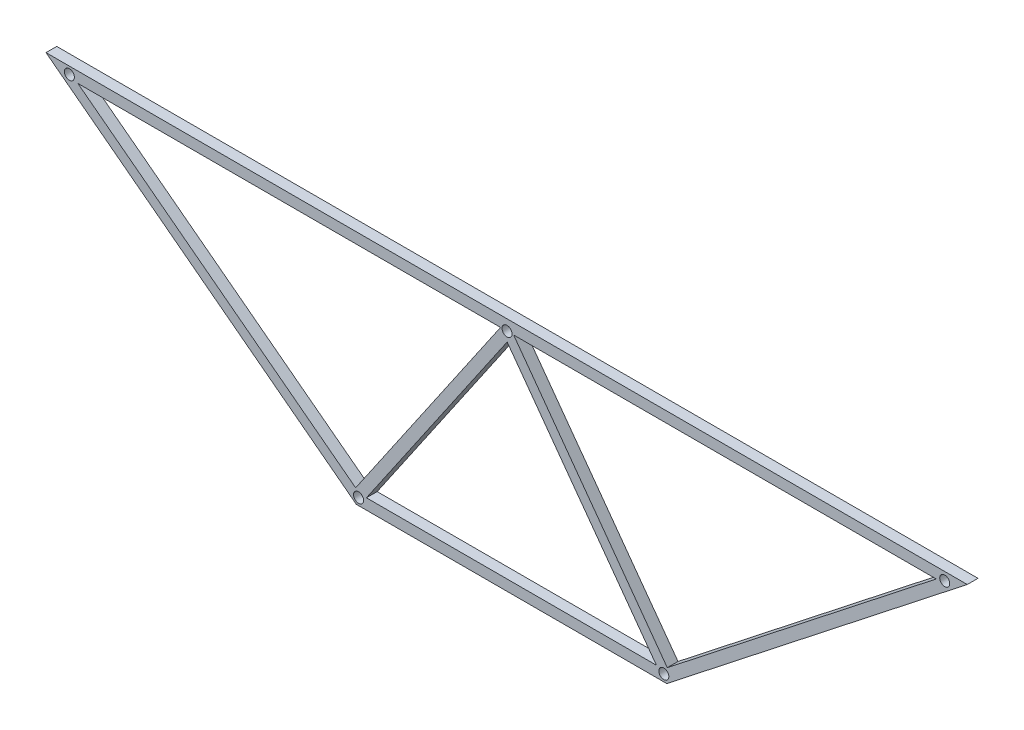
from build123d import *

# Parameters (mm, degrees)
BOSS_EXTRUDE1_DEPTH = 15
SKETCH2_R           = 7
CUT_EXTRUDE2_DEPTH  = 15


with BuildPart() as part:
    # Sketch1 → Boss-Extrude1 (new body)
    with BuildSketch(Plane.XY):
        Polygon((-644.492210058, 15), (643.375012356, 15), (223.310378922, -315), (-210.705614848, -315), align=None)
        Polygon((9.272865978, 0), (600, 0), (224.024883315, -295.363567011), align=None, mode=Mode.SUBTRACT)
        Polygon((-9.092968645, 0), (-600, 0), (-211.624925428, -295.453515678), align=None, mode=Mode.SUBTRACT)
        Polygon((208.850194536, -300), (-196.555581164, -300), (0.180367696, -13.001697737), align=None, mode=Mode.SUBTRACT)
    extrude(amount=BOSS_EXTRUDE1_DEPTH)

    # Sketch2 → Cut-Extrude2 (cut)
    with BuildSketch(Plane.XY.offset(15)):
        with Locations((-611.831081684, 4.904990628)):
            Circle(SKETCH2_R)
        Circle(SKETCH2_R)
        with Locations((611.879096148, 3.706278654)):
            Circle(SKETCH2_R)
        with Locations((-207.544546049, -305.21160756)):
            Circle(SKETCH2_R)
        with Locations((219.201774513, -305.21160756)):
            Circle(SKETCH2_R)
    extrude(amount=-CUT_EXTRUDE2_DEPTH, mode=Mode.SUBTRACT)


solid = part.part
